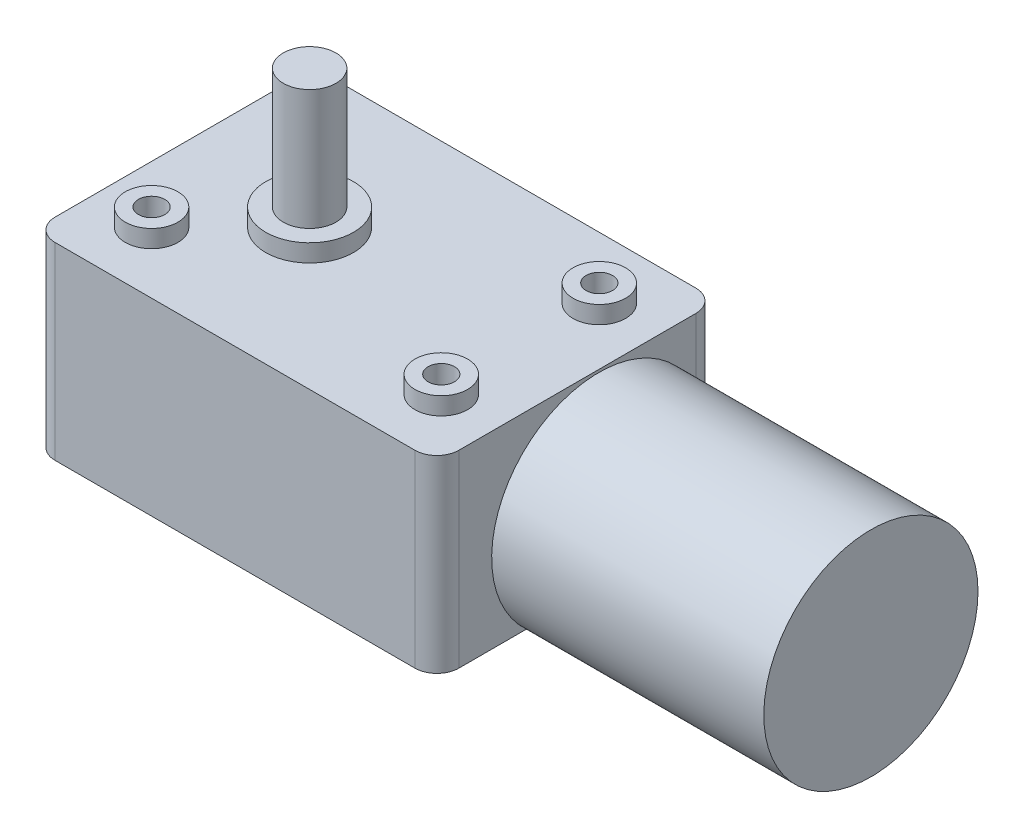
from build123d import *

# Parameters (mm, degrees)
BOSS_EXTRUDE1_DEPTH = 10.75
SKETCH2_R           = 3
SKETCH2_R_2         = 5
BOSS_EXTRUDE2_DEPTH = 2
SKETCH3_R           = 1.5
CUT_EXTRUDE1_DEPTH  = 6
SKETCH4_R           = 3
BOSS_EXTRUDE3_DEPTH = 13.7
SKETCH5_R           = 12.2
BOSS_EXTRUDE4_DEPTH = 31


with BuildPart() as part:
    # Sketch1 → Boss-Extrude1 (new, symmetric)
    with BuildSketch(Plane(origin=(0, 0, 0), x_dir=(1, 0, 0), z_dir=(0, 1, 0))):
        with BuildLine():
            Line((-20.5, -16), (20.5, -16))
            ThreePointArc((20.5, -16), (22.267766953, -15.267766953), (23, -13.5))
            Line((23, -13.5), (23, 13.5))
            ThreePointArc((23, 13.5), (22.267766953, 15.267766953), (20.5, 16))
            Line((20.5, 16), (-20.5, 16))
            ThreePointArc((-20.5, 16), (-22.267766953, 15.267766953), (-23, 13.5))
            Line((-23, 13.5), (-23, -13.5))
            ThreePointArc((-23, -13.5), (-22.267766953, -15.267766953), (-20.5, -16))
        make_face()
    extrude(amount=BOSS_EXTRUDE1_DEPTH, both=True)

    # Sketch2 → Boss-Extrude2 (add)
    with BuildSketch(Plane(origin=(0, 10.75, 0), x_dir=(1, 0, 0), z_dir=(0, 1, 0))):
        with Locations(Location((-16.5, 9, 0), (0, 0, 270))):
            Circle(SKETCH2_R)
        with Locations(Location((-16.5, -9, 0), (0, 0, 270))):
            Circle(SKETCH2_R)
        with Locations(Location((16.5, -9, 0), (0, 0, 270))):
            Circle(SKETCH2_R)
        with Locations(Location((16.5, 9, 0), (0, 0, 270))):
            Circle(SKETCH2_R)
        with Locations(Location((-7.5, 0, 0), (0, 0, 270))):
            Circle(SKETCH2_R_2)
    extrude(amount=BOSS_EXTRUDE2_DEPTH)

    # Sketch3 → Cut-Extrude1 (cut)
    with BuildSketch(Plane(origin=(0, 12.75, 0), x_dir=(1, 0, 0), z_dir=(0, 1, 0))):
        with Locations(Location((-16.5, 9, 0), (0, 0, 270))):
            Circle(SKETCH3_R)
        with Locations(Location((16.5, 9, 0), (0, 0, 270))):
            Circle(SKETCH3_R)
        with Locations(Location((16.5, -9, 0), (0, 0, 270))):
            Circle(SKETCH3_R)
        with Locations(Location((-16.5, -9, 0), (0, 0, 270))):
            Circle(SKETCH3_R)
    extrude(amount=-CUT_EXTRUDE1_DEPTH, mode=Mode.SUBTRACT)

    # Sketch4 → Boss-Extrude3 (add)
    with BuildSketch(Plane(origin=(0, 12.75, 0), x_dir=(1, 0, 0), z_dir=(0, 1, 0))):
        with Locations(Location((-7.5, 0, 0), (0, 0, 90))):
            Circle(SKETCH4_R)
    extrude(amount=BOSS_EXTRUDE3_DEPTH)

    # Sketch5 → Boss-Extrude4 (add)
    with BuildSketch(Plane(origin=(23, 0, 0), x_dir=(0, 0, -1), z_dir=(1, 0, 0))):
        with Locations(Location((2.436698586, -1.75, 0), (0, 0, 227.536275048))):
            Circle(SKETCH5_R)
    extrude(amount=BOSS_EXTRUDE4_DEPTH)


solid = part.part
